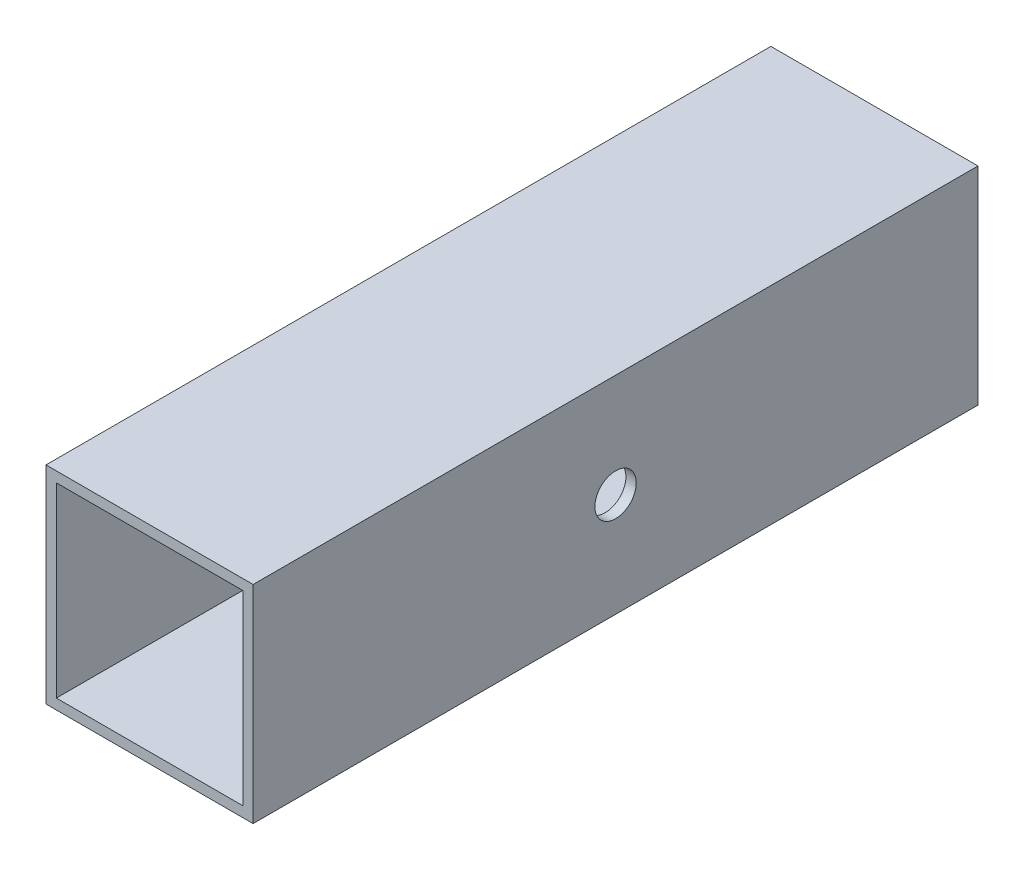
from build123d import *

# Parameters (mm, degrees)
ESQUISSE1_W             = 20
ESQUISSE1_H             = 20
ESQUISSE1_W_2           = 18
ESQUISSE1_H_2           = 18
BOSS_EXTRU_1_DEPTH      = 70
ESQUISSE2_R             = 2
ENL_V_MAT_EXTRU_1_DEPTH = 40


with BuildPart() as part:
    # Esquisse1 → Boss.-Extru.1 (new body)
    with BuildSketch(Plane.XY):
        Rectangle(ESQUISSE1_W, ESQUISSE1_H)
        Rectangle(ESQUISSE1_W_2, ESQUISSE1_H_2, mode=Mode.SUBTRACT)
    extrude(amount=BOSS_EXTRU_1_DEPTH)

    # Esquisse2 → Enlèv. mat.-Extru.1 (cut)
    with BuildSketch(Plane(origin=(10, 0, 0), x_dir=(0, 0, -1), z_dir=(1, 0, 0))):
        with Locations((-35, 0)):
            Circle(ESQUISSE2_R)
    extrude(amount=-ENL_V_MAT_EXTRU_1_DEPTH, mode=Mode.SUBTRACT)


solid = part.part
